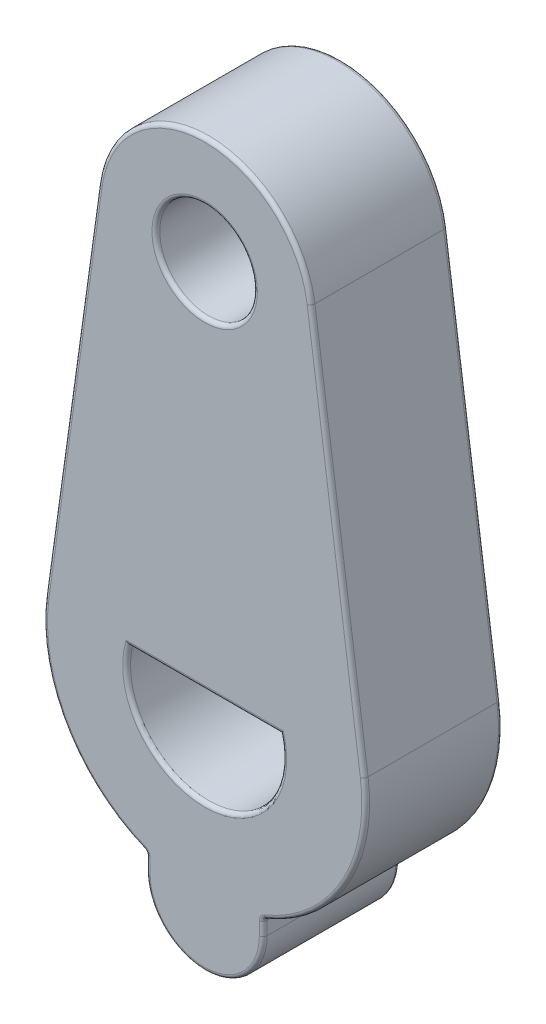
from build123d import *

# Parameters (mm, degrees)
ESQUISSE1_R      = 2.5
EXTRUSION1_DEPTH = 7
ESQUISSE2_R      = 4
EXTRUSION2_DEPTH = 1
CONG_1_R         = 0.2


with BuildPart() as part:
    # Esquisse1 → Extrusion1 (new body)
    with BuildSketch(Plane.XY):
        with BuildLine():
            Line((5.447759717, 20.75625), (8.171639576, 1.134375))
            ThreePointArc((8.171639576, 1.134375), (7.150328566, -4.115252289), (3.124260355, -7.635541712))
            ThreePointArc((3.124260355, -7.635541712), (3.033945899, -7.709173625), (3, -7.820645753))
            Line((3, -7.820645753), (3, -8.5))
            ThreePointArc((3, -8.5), (0, -11.5), (-3, -8.5))
            Line((-3, -8.5), (-3.000624069, -7.820206801))
            ThreePointArc((-3.000624069, -7.820206801), (-3.034616619, -7.708848691), (-3.124869571, -7.635292409))
            ThreePointArc((-3.124869571, -7.635292409), (-7.150492734, -4.11496703), (-8.171639576, 1.134375))
            Line((-8.171639576, 1.134375), (-5.447759717, 20.75625))
            ThreePointArc((-5.447759717, 20.75625), (0, 25.5), (5.447759717, 20.75625))
        make_face()
        with Locations((0, 20)):
            Circle(ESQUISSE1_R, mode=Mode.SUBTRACT)
        with BuildLine():
            Line((-3.872983346, 1), (3.872983346, 1))
            ThreePointArc((3.872983346, 1), (0, -4), (-3.872983346, 1))
        make_face(mode=Mode.SUBTRACT)
    extrude(amount=EXTRUSION1_DEPTH)

    # Esquisse2 → Extrusion2 (add)
    with BuildSketch(Plane(origin=(0, 0, 0), x_dir=(-1, 0, 0), z_dir=(0, 0, -1))):
        with Locations(Location((0, 20, 0), (0, 0, 180))):
            Circle(ESQUISSE2_R)
    extrude(amount=EXTRUSION2_DEPTH)

    # Congé1
    cong_1_edges = [part.edges().sort_by_distance(p)[0] for p in [
        (-6.809699647, 10.9453125, 0),
        (-6.809699647, 10.9453125, 7),
        (-7.150492734, -4.11496703, 0),
        (-7.150492734, -4.11496703, 7),
        (0, 25.5, 0),
        (0, 25.5, 7),
        (-3.034616619, -7.708848691, 0),
        (6.809699647, 10.9453125, 0),
        (-3.000312035, -8.1601034, 0),
        (7.150328566, -4.115252289, 0),
        (0, -11.5, 0),
        (3.033945899, -7.709173625, 0),
        (3, -8.160322877, 0),
        (0, -4, 0),
        (0, 1, 0),
        (-4, 20, 0),
        (6.809699647, 10.9453125, 7),
        (7.150328566, -4.115252289, 7),
        (3.033945899, -7.709173625, 7),
        (3, -8.160322877, 7),
        (0, -11.5, 7),
        (-3.000312035, -8.1601034, 7),
        (-3.034616619, -7.708848691, 7),
        (-2.5, 20, 7),
        (0, -4, 7),
        (0, 1, 7),
        (-4, 20, -1),
    ]]
    fillet(cong_1_edges, radius=CONG_1_R)


solid = part.part
